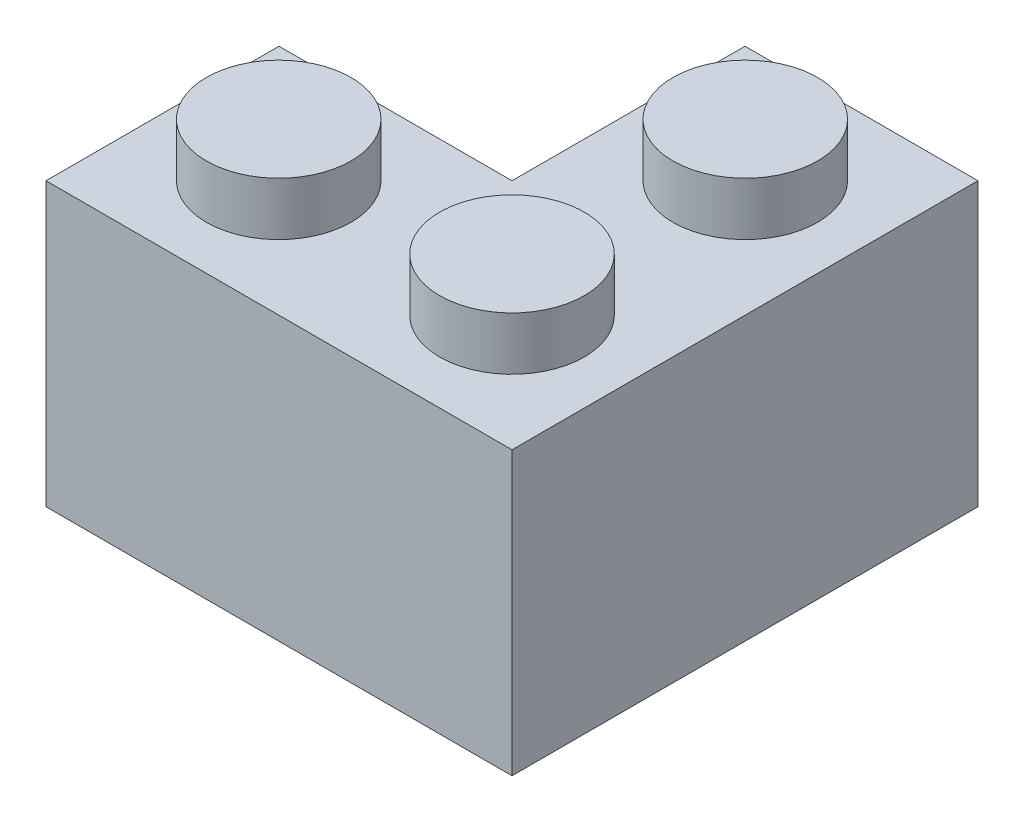
from build123d import *

# Parameters (mm, degrees)
BOSS_EXTRUDE1_DEPTH = 9.56
SKETCH2_R           = 2.45
BOSS_EXTRUDE2_DEPTH = 1.8
SHELL1_T            = -1.5
SKETCH3_R           = 1.48
BOSS_EXTRUDE4_DEPTH = 7.86


with BuildPart() as part:
    # Sketch1 → Boss-Extrude1 (new body)
    with BuildSketch(Plane(origin=(0, 0, 0), x_dir=(1, 0, 0), z_dir=(0, 1, 0))):
        Polygon((0, 0), (0, 7.89), (7.89, 7.89), (7.89, -7.89), (-7.89, -7.89), (-7.89, 0), align=None)
    extrude(amount=-BOSS_EXTRUDE1_DEPTH)

    # Sketch2 → Boss-Extrude2 (add)
    with BuildSketch(Plane(origin=(0, 0, 0), x_dir=(1, 0, 0), z_dir=(0, 1, 0))):
        with Locations(Location((3.945, -3.945, 0), (0, 0, 270))):
            Circle(SKETCH2_R)
        with Locations(Location((3.945, 3.955, 0), (0, 0, 270))):
            Circle(SKETCH2_R)
        with Locations(Location((-3.955, -3.945, 0), (0, 0, 270))):
            Circle(SKETCH2_R)
    extrude(amount=BOSS_EXTRUDE2_DEPTH)

    # Shell1
    shell1_openings = [part.faces().sort_by_distance(p)[0] for p in [
        (1.315, -9.56, 1.315),
    ]]
    offset(amount=SHELL1_T, openings=shell1_openings, kind=Kind.INTERSECTION)

    # Sketch3 → Boss-Extrude4 (add)
    with BuildSketch(Plane.XZ.offset(1.5)):
        with Locations(Location((0, 3.945, 0), (0, 0, 90))):
            Circle(SKETCH3_R)
        with Locations(Location((3.945, 0, 0), (0, 0, 90))):
            Circle(SKETCH3_R)
    extrude(amount=BOSS_EXTRUDE4_DEPTH)


solid = part.part
